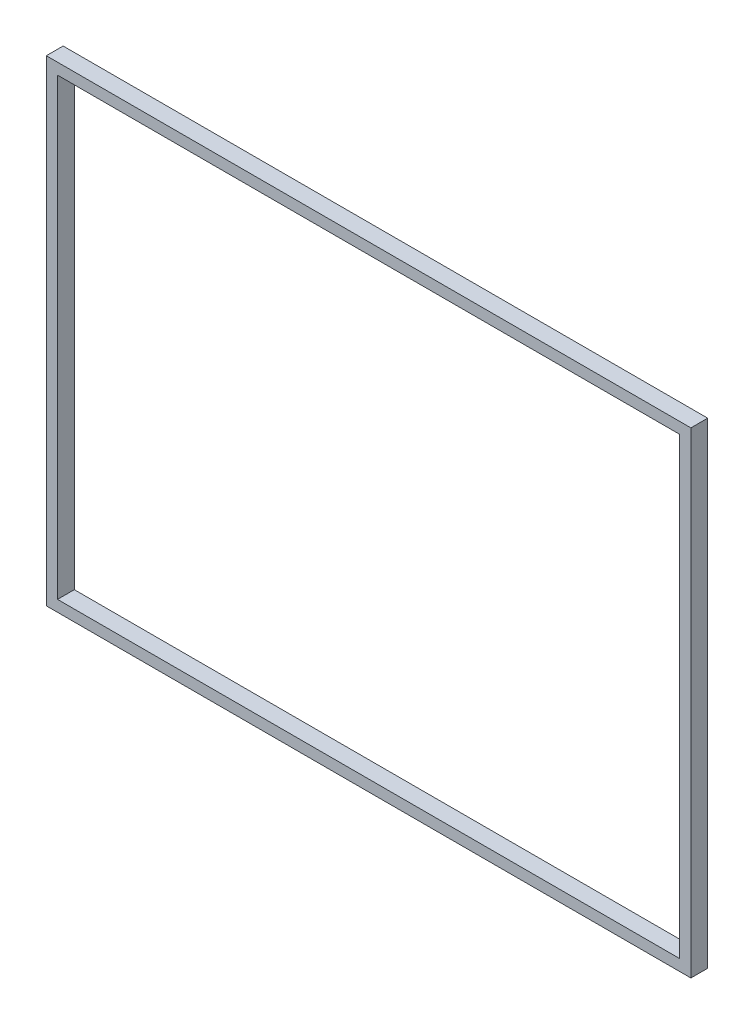
from build123d import *

# Parameters (mm, degrees)
ESBO_O1_W                = 115
ESBO_O1_H                = 85
ESBO_O1_W_2              = 111
ESBO_O1_H_2              = 81
RESSALTO_EXTRUS_O1_DEPTH = 3


with BuildPart() as part:
    # Esboço1 → Ressalto-extrusão1 (new body)
    with BuildSketch(Plane.XY):
        with Locations((-21.020902833, -6.717490466)):
            Rectangle(ESBO_O1_W, ESBO_O1_H)
        with Locations((-21.020902833, -6.717490466)):
            Rectangle(ESBO_O1_W_2, ESBO_O1_H_2, mode=Mode.SUBTRACT)
    extrude(amount=RESSALTO_EXTRUS_O1_DEPTH)


solid = part.part
